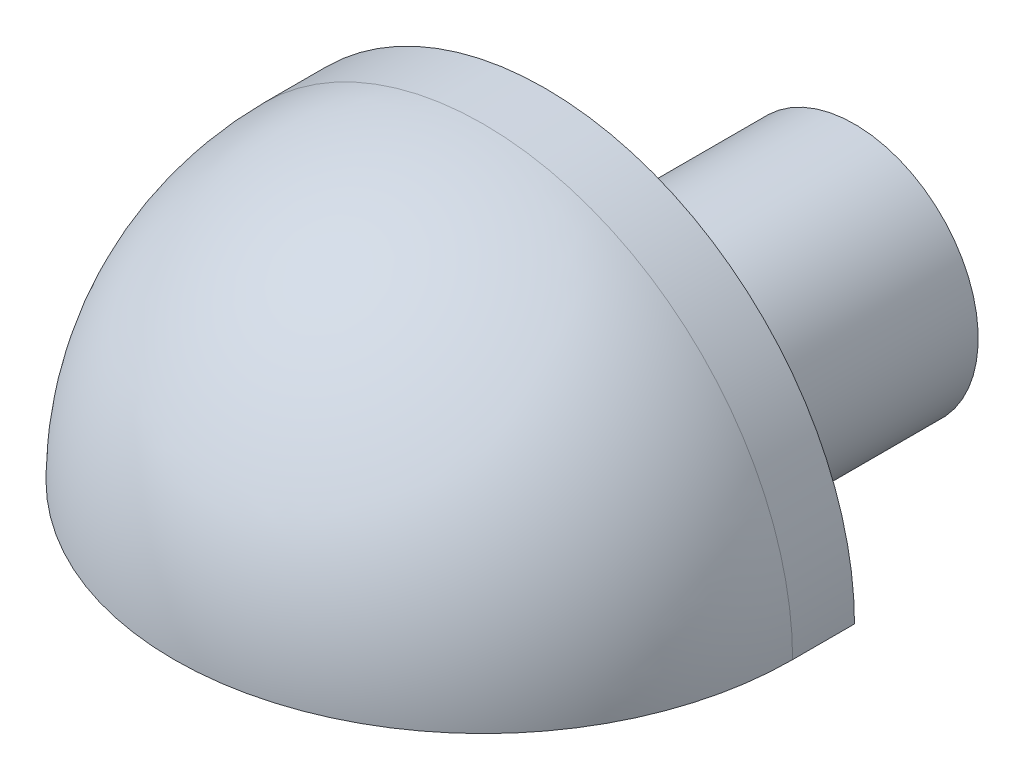
from build123d import *

# Parameters (mm, degrees)
SALIENTE_EXTRUIR1_DEPTH = 3
REVOLUCI_N1_ANGLE       = 180
SALIENTE_EXTRUIR2_DEPTH = 3
CROQUIS4_R              = 1.6
CORTAR_EXTRUIR1_DEPTH   = 3
SALIENTE_EXTRUIR3_START = 15
CROQUIS5_R              = 6
CROQUIS5_R_2            = 1.6
SALIENTE_EXTRUIR3_DEPTH = 15


with BuildPart() as part:
    # Croquis1 → Saliente-Extruir1 (new body)
    with BuildSketch(Plane.XY):
        with BuildLine():
            Line((-80.787332882, 3.645984144), (-50.787332882, 3.645984144))
            ThreePointArc((-50.787332882, 3.645984144), (-65.787332882, 18.645984144), (-80.787332882, 3.645984144))
        make_face()
    extrude(amount=SALIENTE_EXTRUIR1_DEPTH)

    # Croquis2 → Revolución1 (revolve)
    with BuildSketch(Plane.XZ.offset(-3.645984144)):
        with BuildLine():
            Line((-65.787332882, 18), (-65.787332882, 16.2))
            ThreePointArc((-65.787332882, 16.2), (-75.121142393, 12.333809512), (-78.987332882, 3))
            Line((-78.987332882, 3), (-80.787332882, 3))
            ThreePointArc((-80.787332882, 3), (-76.393934599, 13.606601718), (-65.787332882, 18))
        make_face()
    revolve(axis=Axis((-65.787332882, 3.645984144, 3), (0, 0, -1)), revolution_arc=REVOLUCI_N1_ANGLE)

    # Croquis3 → Saliente-Extruir2 (add)
    with BuildSketch(Plane(origin=(0, 0, 0), x_dir=(-1, 0, 0), z_dir=(0, 0, -1))):
        with BuildLine():
            Line((65.787332882, 3.645984144), (71.787332882, 3.645984144))
            ThreePointArc((71.787332882, 3.645984144), (65.787332882, -2.354015856), (59.787332882, 3.645984144))
            Line((59.787332882, 3.645984144), (65.787332882, 3.645984144))
        make_face()
    extrude(amount=-SALIENTE_EXTRUIR2_DEPTH)

    # Croquis4 → Cortar-Extruir1 (cut)
    with BuildSketch(Plane(origin=(0, 0, 0), x_dir=(-1, 0, 0), z_dir=(0, 0, -1))):
        with Locations((65.787332882, 3.645984144)):
            Circle(CROQUIS4_R)
    extrude(amount=-CORTAR_EXTRUIR1_DEPTH, mode=Mode.SUBTRACT)

    # Croquis5 → Saliente-Extruir3 (add)
    with BuildSketch(Plane(origin=(0, 0, 0), x_dir=(-1, 0, 0), z_dir=(0, 0, -1)).offset(SALIENTE_EXTRUIR3_START)):
        with Locations((65.787332882, 3.645984144)):
            Circle(CROQUIS5_R)
        with Locations((65.787332882, 3.645984144)):
            Circle(CROQUIS5_R_2, mode=Mode.SUBTRACT)
    extrude(amount=-SALIENTE_EXTRUIR3_DEPTH)


solid = part.part
